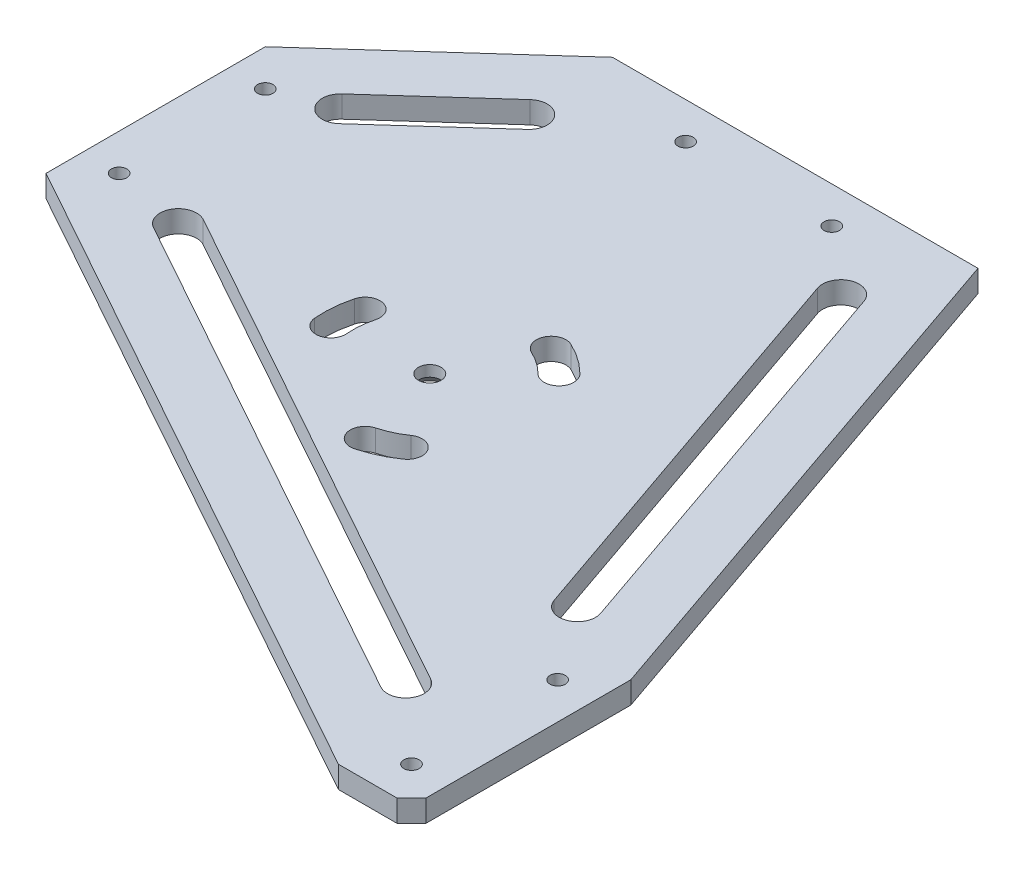
from build123d import *

# Parameters (mm, degrees)
SKETCH_1_R               = 3.1
SKETCH_1_R_2             = 2.1
EXTRUDE_1_DEPTH          = 3
CHAMFER_1_SIZE           = 2
CHAMFER_3_SIZE           = 4
CUT_EXTRUDE_1_DEPTH      = 146.124084838
CHAMFER_4_SIZE           = 3
CUT_EXTRUDE_2_DEPTH      = 146.124084838
PATTERN_CIRCULAR_1_COUNT = 3


with BuildPart() as part:
    # 草图1 → 凸台-拉伸1 (new, symmetric)
    with BuildSketch(Plane(origin=(0, 0, 0), x_dir=(1, 0, 0), z_dir=(0, 1, 0))):
        Polygon((-50, 100), (50, 100), (100, -45), (100, -105), (80, -105), (-100, -5), (-100, 55), align=None)
        with Locations(Location((0, 0, 0), (0, 0, 270))):
            Circle(SKETCH_1_R, mode=Mode.SUBTRACT)
        with Locations(Location((-20, 90, 0), (0, 0, 270))):
            Circle(SKETCH_1_R_2, mode=Mode.SUBTRACT)
        with Locations(Location((-90, 45, 0), (0, 0, 270))):
            Circle(SKETCH_1_R_2, mode=Mode.SUBTRACT)
        with Locations(Location((-90, 5, 0), (0, 0, 270))):
            Circle(SKETCH_1_R_2, mode=Mode.SUBTRACT)
        with Locations(Location((20, 90, 0), (0, 0, 90))):
            Circle(SKETCH_1_R_2, mode=Mode.SUBTRACT)
        with Locations(Location((90, -55, 0), (0, 0, 270))):
            Circle(SKETCH_1_R_2, mode=Mode.SUBTRACT)
        with Locations(Location((90, -95, 0), (0, 0, 270))):
            Circle(SKETCH_1_R_2, mode=Mode.SUBTRACT)
    extrude(amount=EXTRUDE_1_DEPTH, both=True)

    # 倒角1
    chamfer_1_edges = [part.edges().sort_by_distance(p)[0] for p in [
        (-20, -3, -92.1),
        (-90, -3, -47.1),
        (-90, -3, -7.1),
        (90, -3, 52.9),
        (90, -3, 92.9),
        (20, -3, -87.9),
    ]]
    chamfer(chamfer_1_edges, length=CHAMFER_1_SIZE)

    # 倒角3
    chamfer_3_edges = [part.edges().sort_by_distance(p)[0] for p in [
        (100, 0, 105),
    ]]
    chamfer(chamfer_3_edges, length=CHAMFER_3_SIZE)

    # 草图2 → 切除-拉伸1 (cut, through all)
    with BuildSketch(Plane(origin=(0, 3, 0), x_dir=(1, 0, 0), z_dir=(0, 1, 0))):
        with BuildLine():
            Line((-78.344823658, 54.309222637), (-51.225659109, 78.716470731))
            ThreePointArc((-51.225659109, 78.716470731), (-44.16436472, 78.344823658), (-44.536011793, 71.283529269))
            Line((-44.536011793, 71.283529269), (-71.655176342, 46.876281175))
            ThreePointArc((-71.655176342, 46.876281175), (-78.716470731, 47.247928248), (-78.344823658, 54.309222637))
        make_face()
        with BuildLine():
            Line((70.669187988, -36.629953417), (32.738153505, 73.370046583))
            ThreePointArc((32.738153505, 73.370046583), (35.835064997, 79.726864908), (42.191883322, 76.629953417))
            Line((42.191883322, 76.629953417), (80.122917804, -33.370046583))
            ThreePointArc((80.122917804, -33.370046583), (77.026006313, -39.726864908), (70.669187988, -36.629953417))
        make_face()
        with BuildLine():
            Line((67.571785344, -80.936052734), (-72.428214656, -3.158274956))
            ThreePointArc((-72.428214656, -3.158274956), (-74.370786381, 3.64072608), (-67.571785344, 5.583297805))
            Line((-67.571785344, 5.583297805), (72.428214656, -72.194479973))
            ThreePointArc((72.428214656, -72.194479973), (74.370786381, -78.993481009), (67.571785344, -80.936052734))
        make_face()
    extrude(amount=-CUT_EXTRUDE_1_DEPTH, mode=Mode.SUBTRACT)

    # 倒角4
    chamfer_4_edges = [part.edges().sort_by_distance(p)[0] for p in [
        (0, -3, -3.1),
    ]]
    chamfer(chamfer_4_edges, length=CHAMFER_4_SIZE)

    # 草图3 → 切除-拉伸2 (cut, through all)
    with BuildSketch(Plane.XZ.offset(3)):
        with BuildLine():
            ThreePointArc((12.277060504, -26.328241213), (16.662395476, -23.796366887), (20.541451993, -20.541451993))
            ThreePointArc((20.541451993, -20.541451993), (20.541451993, -14.813887066), (14.813887066, -14.813887066))
            ThreePointArc((14.813887066, -14.813887066), (12.016426342, -17.161235328), (8.853852583, -18.987148138))
            ThreePointArc((8.853852583, -18.987148138), (6.894910006, -24.369298636), (12.277060504, -26.328241213))
        make_face()
    cut_extrude_2 = extrude(amount=-CUT_EXTRUDE_2_DEPTH, mode=Mode.SUBTRACT)

    # 阵列(圆周)1: 切除-拉伸2 ×3 about axis
    pattern_circular_1_axis = Axis((0, 0, 0), (0, 1, 0))
    for i in range(1, PATTERN_CIRCULAR_1_COUNT):
        add(cut_extrude_2.rotate(pattern_circular_1_axis, i * 360 / PATTERN_CIRCULAR_1_COUNT), mode=Mode.SUBTRACT)


solid = part.part
